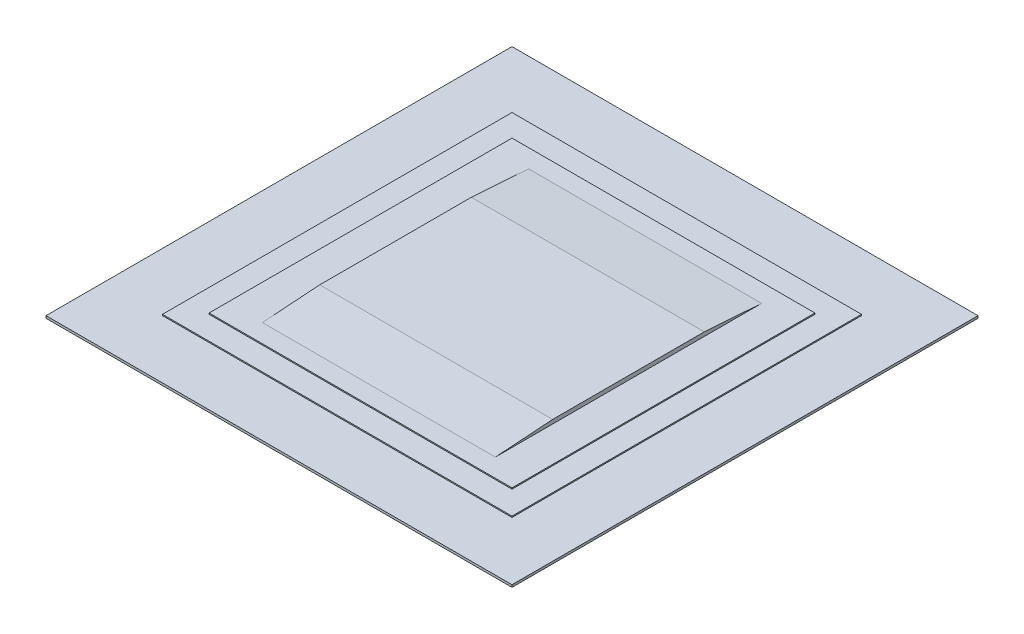
from build123d import *

# Parameters (mm, degrees)
ESQUISSE1_W        = 2000
ESQUISSE1_H        = 2000
BOSS_EXTRU_1_DEPTH = 10
ESQUISSE3_W        = 1500
ESQUISSE3_H        = 1500
BOSS_EXTRU_2_DEPTH = 5
ESQUISSE4_W        = 1300
ESQUISSE4_H        = 1300
BOSS_EXTRU_3_DEPTH = 5
BOSS_EXTRU_5_DEPTH = 500


with BuildPart() as part:
    # Esquisse1 → Boss.-Extru.1 (new body)
    with BuildSketch(Plane(origin=(0, 0, 0), x_dir=(1, 0, 0), z_dir=(0, 1, 0))):
        Rectangle(ESQUISSE1_W, ESQUISSE1_H)
    extrude(amount=BOSS_EXTRU_1_DEPTH)

    # Esquisse3 → Boss.-Extru.2 (add)
    with BuildSketch(Plane(origin=(0, 10, 0), x_dir=(1, 0, 0), z_dir=(0, 1, 0))):
        Rectangle(ESQUISSE3_W, ESQUISSE3_H)
    extrude(amount=BOSS_EXTRU_2_DEPTH)

    # Esquisse4 → Boss.-Extru.3 (add)
    with BuildSketch(Plane(origin=(0, 15, 0), x_dir=(1, 0, 0), z_dir=(0, 1, 0))):
        Rectangle(ESQUISSE4_W, ESQUISSE4_H)
    extrude(amount=BOSS_EXTRU_3_DEPTH)

    # Esquisse8 → Boss.-Extru.5 (add, symmetric)
    with BuildSketch(Plane(origin=(0, 0, 0), x_dir=(0, 0, -1), z_dir=(1, 0, 0))):
        Polygon((325.45099137, 37.196428785), (-325.45099137, 37.196428785), (-571.371380234, 20), (571.371380234, 20), align=None)
    extrude(amount=BOSS_EXTRU_5_DEPTH, both=True)


solid = part.part
